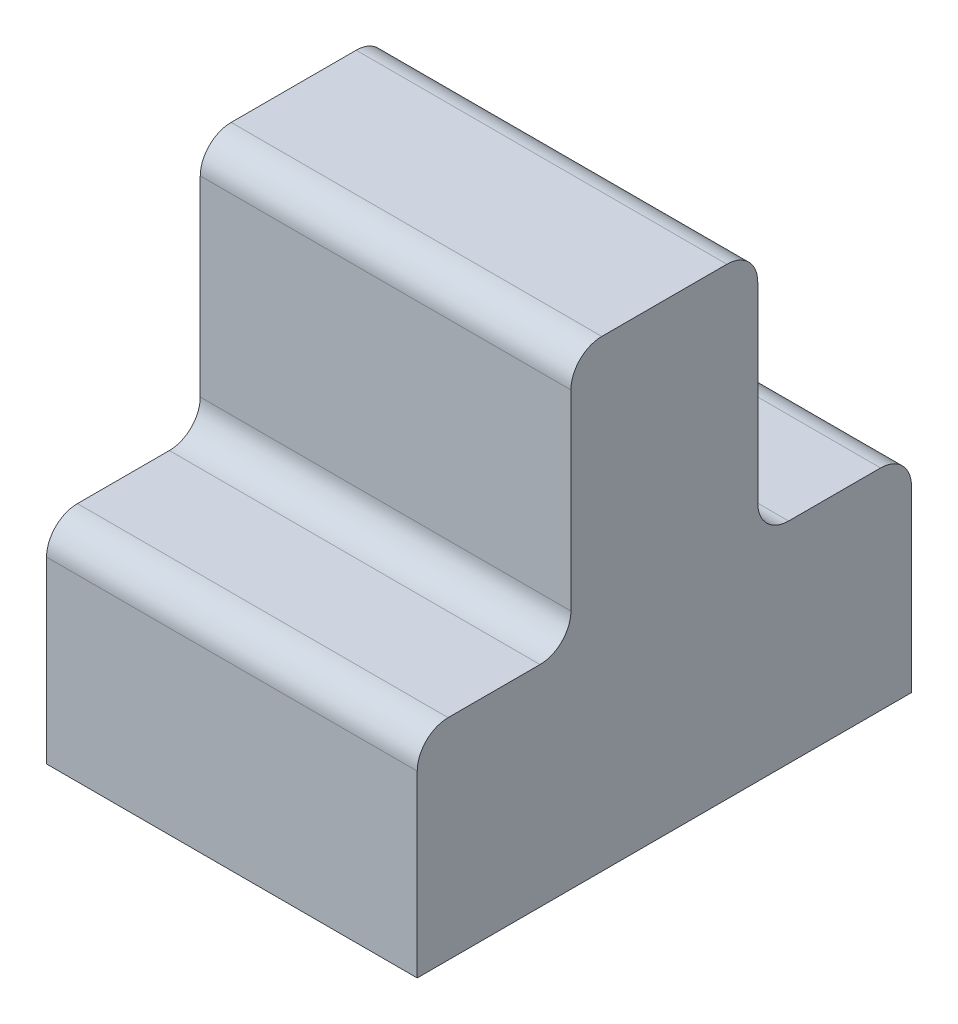
from build123d import *

# Parameters (mm, degrees)
BOSS_EXTRUDE1_DEPTH  = 12
FILLET1_R            = 1
FILLET1_OF_MIRROR2_R = 1


with BuildPart() as part:
    # Sketch1 → Boss-Extrude1 (new body)
    with BuildSketch(Plane(origin=(0, 0, 0), x_dir=(0, 0, -1), z_dir=(1, 0, 0))):
        Polygon((0, 6.800479655), (0, 0), (8, 0), (8, 15), (4.975646797, 15), (4.975646797, 6.800479655), align=None)
    boss_extrude1 = extrude(amount=BOSS_EXTRUDE1_DEPTH)

    # Fillet1
    fillet1_edges = [part.edges().sort_by_distance(p)[0] for p in [
        (6, 6.800479655, 0),
        (6, 6.800479655, -4.975646797),
        (6, 15, -4.975646797),
    ]]
    fillet(fillet1_edges, radius=FILLET1_R)

    # Mirror2: Boss-Extrude1 across plane
    add(boss_extrude1.mirror(Plane(origin=(12, 0, -8), x_dir=(1, 0, 0), z_dir=(0, 0, 1))))

    # Fillet1 of Mirror2
    fillet1_of_mirror2_edges = [part.edges().sort_by_distance(p)[0] for p in [
        (6, 6.800479655, -16),
        (6, 6.800479655, -11.024353203),
        (6, 15, -11.024353203),
    ]]
    fillet(fillet1_of_mirror2_edges, radius=FILLET1_OF_MIRROR2_R)


solid = part.part
